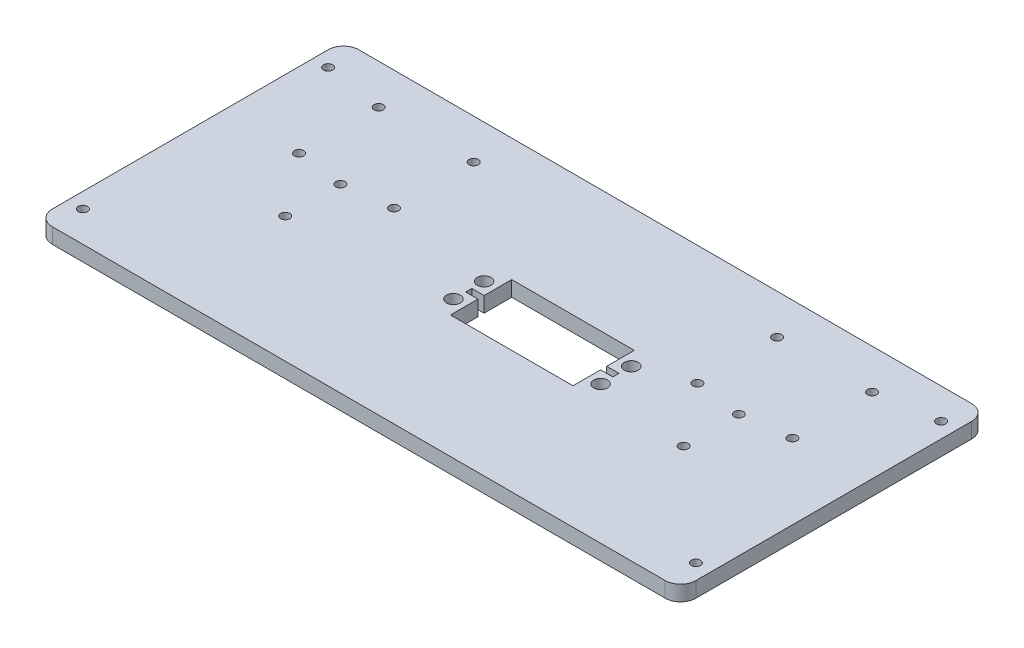
from build123d import *

# Parameters (mm, degrees)
SKETCH_1_W          = 210
SKETCH_1_H          = 100
EXTRUDE_1_DEPTH     = 5
FILLET_1_R          = 5
SKETCH_2_R          = 1.5
CUT_EXTRUDE_1_DEPTH = 5
SKETCH_4_R          = 2.25
CUT_EXTRUDE_2_DEPTH = 5
SKETCH_6_R          = 1.5
CUT_EXTRUDE_3_DEPTH = 5


with BuildPart() as part:
    # 草图1 → 凸台-拉伸1 (new body)
    with BuildSketch(Plane(origin=(0, 0, 0), x_dir=(1, 0, 0), z_dir=(0, 1, 0))):
        with Locations((-105, 50)):
            Rectangle(SKETCH_1_W, SKETCH_1_H)
    extrude(amount=EXTRUDE_1_DEPTH)

    # 圆角1
    fillet_1_edges = [part.edges().sort_by_distance(p)[0] for p in [
        (-210, 2.5, -100),
        (0, 2.5, -100),
        (0, 2.5, 0),
        (-210, 2.5, 0),
    ]]
    fillet(fillet_1_edges, radius=FILLET_1_R)

    # 草图2 → 切除-拉伸1 (cut)
    with BuildSketch(Plane(origin=(0, 5, 0), x_dir=(1, 0, 0), z_dir=(0, 1, 0))):
        with Locations(Location((-205, 90, 0), (0, 0, 270))):
            Circle(SKETCH_2_R)
        with Locations(Location((-205, 10, 0), (0, 0, 270))):
            Circle(SKETCH_2_R)
        with Locations(Location((-5, 10, 0), (0, 0, 270))):
            Circle(SKETCH_2_R)
        with Locations(Location((-5, 90, 0), (0, 0, 270))):
            Circle(SKETCH_2_R)
    extrude(amount=-CUT_EXTRUDE_1_DEPTH, mode=Mode.SUBTRACT)

    # 草图4 → 切除-拉伸2 (cut)
    with BuildSketch(Plane.XZ):
        with Locations(Location((-119.1, -45, 0), (0, 0, 270))):
            Circle(SKETCH_4_R)
        with Locations(Location((-119.1, -55, 0), (0, 0, 90))):
            Circle(SKETCH_4_R)
        with Locations(Location((-71.1, -55, 0), (0, 0, 270))):
            Circle(SKETCH_4_R)
        with Locations(Location((-71.1, -45, 0), (0, 0, 90))):
            Circle(SKETCH_4_R)
        Polygon((-115.1, -60), (-75.1, -60), (-75.1, -51), (-71.1, -51), (-71.1, -49), (-75.1, -49), (-75.1, -40), (-115.1, -40), (-115.1, -49), (-119.1, -49), (-119.1, -51), (-115.1, -51), align=None)
    extrude(amount=-CUT_EXTRUDE_2_DEPTH, mode=Mode.SUBTRACT)

    # 草图6 → 切除-拉伸3 (cut)
    with BuildSketch(Plane.XZ):
        with Locations(Location((-40, -41, 0), (0, 0, 270))):
            Circle(SKETCH_6_R)
        with Locations(Location((-40, -59, 0), (0, 0, 270))):
            Circle(SKETCH_6_R)
        with Locations(Location((-170, -59, 0), (0, 0, 90))):
            Circle(SKETCH_6_R)
        with Locations(Location((-170, -41, 0), (0, 0, 90))):
            Circle(SKETCH_6_R)
        with Locations(Location((-185.5, -87, 0), (0, 0, 270))):
            Circle(SKETCH_6_R)
        with Locations(Location((-185.5, -61, 0), (0, 0, 270))):
            Circle(SKETCH_6_R)
        with Locations(Location((-154.5, -87, 0), (0, 0, 90))):
            Circle(SKETCH_6_R)
        with Locations(Location((-154.5, -61, 0), (0, 0, 90))):
            Circle(SKETCH_6_R)
        with Locations(Location((-55.5, -87, 0), (0, 0, 270))):
            Circle(SKETCH_6_R)
        with Locations(Location((-24.5, -87, 0), (0, 0, 90))):
            Circle(SKETCH_6_R)
        with Locations(Location((-55.5, -61, 0), (0, 0, 270))):
            Circle(SKETCH_6_R)
        with Locations(Location((-24.5, -61, 0), (0, 0, 90))):
            Circle(SKETCH_6_R)
    extrude(amount=-CUT_EXTRUDE_3_DEPTH, mode=Mode.SUBTRACT)


solid = part.part
